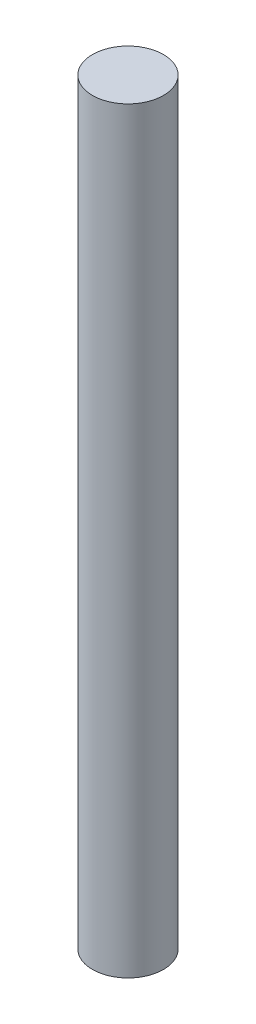
from build123d import *

# Parameters (mm, degrees)
SKETCH1_R           = 1.5
BOSS_EXTRUDE1_DEPTH = 32


with BuildPart() as part:
    # Sketch1 → Boss-Extrude1 (new body)
    with BuildSketch(Plane(origin=(0, 0, 0), x_dir=(1, 0, 0), z_dir=(0, 1, 0))):
        with Locations(Location((0, 0, 0), (0, 0, 270))):
            Circle(SKETCH1_R)
    extrude(amount=BOSS_EXTRUDE1_DEPTH)


solid = part.part
